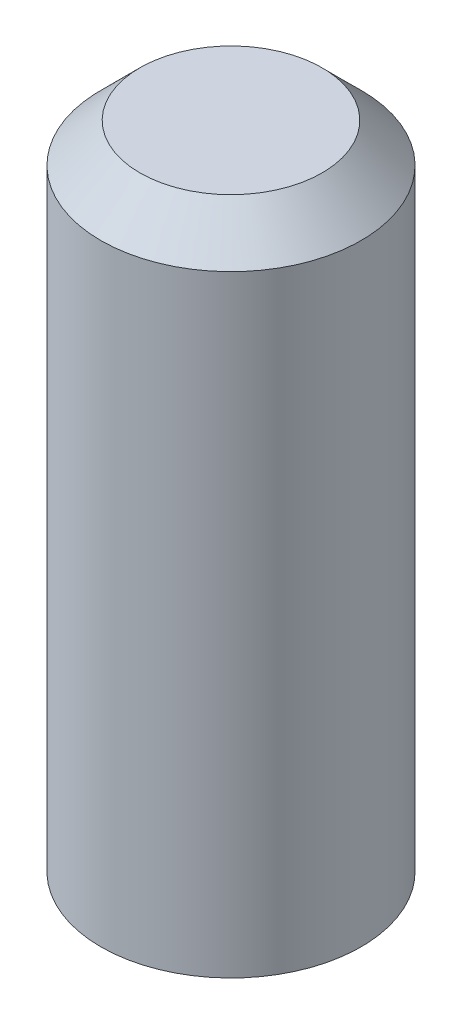
from build123d import *

# Parameters (mm, degrees)
SKETCH_1_R      = 2
EXTRUDE_1_DEPTH = 10
CHAMFER_1_SIZE  = 0.6


with BuildPart() as part:
    # Эскиз1 → Бобышка-Вытянуть1 (new body)
    with BuildSketch(Plane(origin=(0, 0, 0), x_dir=(1, 0, 0), z_dir=(0, 1, 0))):
        with Locations(Location((0, 0, 0), (0, 0, 270))):
            Circle(SKETCH_1_R)
    extrude(amount=EXTRUDE_1_DEPTH)

    # Фаска1
    chamfer_1_edges = [part.edges().sort_by_distance(p)[0] for p in [
        (0, 10, -2),
    ]]
    chamfer(chamfer_1_edges, length=CHAMFER_1_SIZE)


solid = part.part
